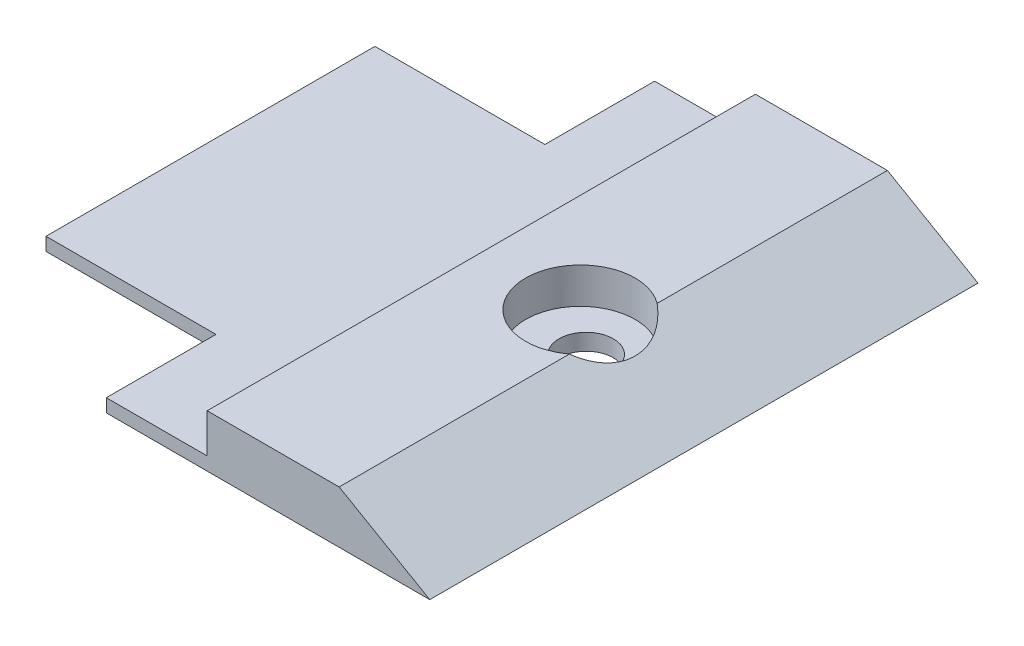
from build123d import *

# Parameters (mm, degrees)
SALIENTE_EXTRUIR1_DEPTH = 4.77
CORTAR_EXTRUIR1_START   = -40
CROQUIS2_W              = 24.7
CROQUIS2_H              = 3.57
CORTAR_EXTRUIR1_DEPTH   = 50
CORTAR_EXTRUIR2_START   = -50
CORTAR_EXTRUIR2_DEPTH   = 50
CORTAR_EXTRUIR3_START   = -4.77
CROQUIS4_R              = 2.474873734
CORTAR_EXTRUIR3_DEPTH   = 4.77
CROQUIS5_R              = 5
CORTAR_EXTRUIR4_DEPTH   = 3.27


with BuildPart() as part:
    # Croquis1 → Saliente-Extruir1 (new body)
    with BuildSketch(Plane(origin=(0, 0, 0), x_dir=(1, 0, 0), z_dir=(0, 1, 0))):
        Polygon((0, 0), (15.5, 0), (15.5, -10), (45, -10), (45, 40), (15.5, 40), (15.5, 30), (0, 30), align=None)
    extrude(amount=SALIENTE_EXTRUIR1_DEPTH)

    # Croquis2 → Cortar-Extruir1 (cut)
    with BuildSketch(Plane.XY.offset(CORTAR_EXTRUIR1_START)):
        with Locations((12.35, 2.985)):
            Rectangle(CROQUIS2_W, CROQUIS2_H)
    extrude(amount=CORTAR_EXTRUIR1_DEPTH, mode=Mode.SUBTRACT)

    # Croquis3 → Cortar-Extruir2 (cut)
    with BuildSketch(Plane.XY.offset(10).offset(CORTAR_EXTRUIR2_START)):
        Polygon((45, 0), (36.738117648, 4.77), (45, 4.77), align=None)
    extrude(amount=CORTAR_EXTRUIR2_DEPTH, mode=Mode.SUBTRACT)

    # Croquis4 → Cortar-Extruir3 (cut)
    with BuildSketch(Plane(origin=(0, 4.77, 0), x_dir=(1, 0, 0), z_dir=(0, 1, 0)).offset(CORTAR_EXTRUIR3_START)):
        with Locations(Location((34.263243914, 15, 0), (0, 0, 270))):
            Circle(CROQUIS4_R)
    extrude(amount=CORTAR_EXTRUIR3_DEPTH, mode=Mode.SUBTRACT)

    # Croquis5 → Cortar-Extruir4 (cut)
    with BuildSketch(Plane(origin=(0, 4.77, 0), x_dir=(1, 0, 0), z_dir=(0, 1, 0))):
        with Locations(Location((33.738117648, 15, 0), (0, 0, 270))):
            Circle(CROQUIS5_R)
    extrude(amount=-CORTAR_EXTRUIR4_DEPTH, mode=Mode.SUBTRACT)


solid = part.part
